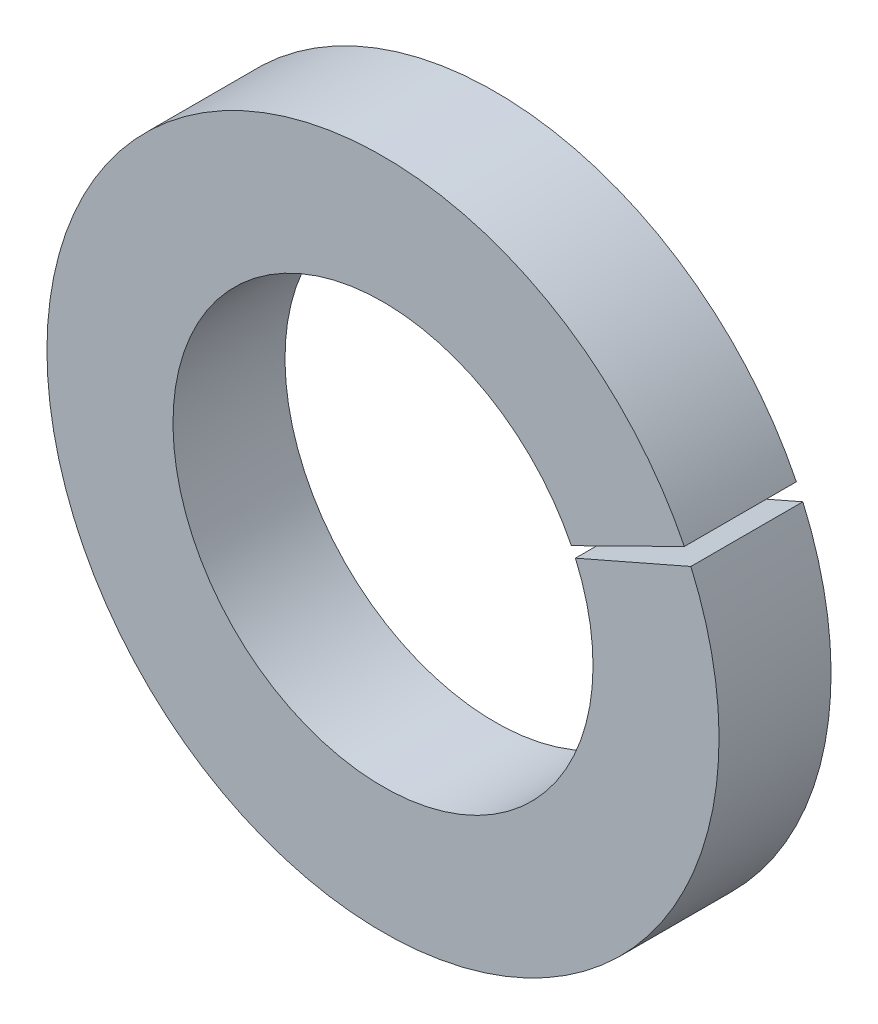
from build123d import *

# Parameters (mm, degrees)
SKETCH_1_R          = 4.8
SKETCH_1_R_2        = 3
EXTRUDE_1_DEPTH     = 1.6
CUT_EXTRUDE_1_DEPTH = 10


with BuildPart() as part:
    # 草图1 → 凸台-拉伸1 (new body)
    with BuildSketch(Plane.XY):
        Circle(SKETCH_1_R)
        Circle(SKETCH_1_R_2, mode=Mode.SUBTRACT)
    extrude(amount=EXTRUDE_1_DEPTH)

    # 草图2 → 切除-拉伸1 (cut)
    with BuildSketch(Plane.XY.offset(1.6)):
        Polygon((0, 0), (4.812459265, 2.375572201), (4.812459265, 2.105870497), align=None)
    extrude(amount=-CUT_EXTRUDE_1_DEPTH, mode=Mode.SUBTRACT)


solid = part.part
